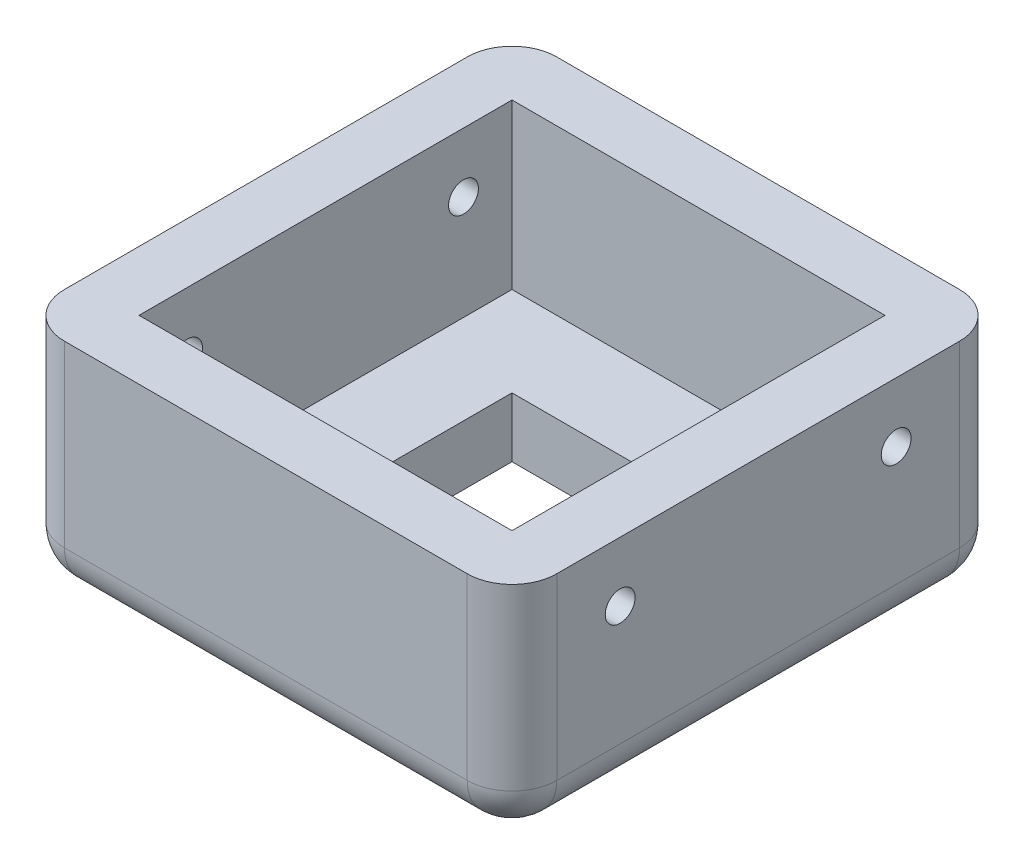
from build123d import *

# Parameters (mm, degrees)
SKETCH_1_W          = 33
SKETCH_1_H          = 33
SKETCH_1_W_2        = 13
SKETCH_1_H_2        = 13
EXTRUDE_1_DEPTH     = 15
SKETCH_2_W          = 25
SKETCH_2_H          = 25
CUT_EXTRUDE_1_DEPTH = 11
FILLET_3_R          = 3
SKETCH_4_R          = 1
CUT_EXTRUDE_2_DEPTH = 43.930175867


with BuildPart() as part:
    # Эскиз1 → Бобышка-Вытянуть1 (new body)
    with BuildSketch(Plane(origin=(0, 0, 0), x_dir=(1, 0, 0), z_dir=(0, 1, 0))):
        with Locations((6.5, 6.5)):
            Rectangle(SKETCH_1_W, SKETCH_1_H)
        with Locations((6.5, 6.5)):
            Rectangle(SKETCH_1_W_2, SKETCH_1_H_2, mode=Mode.SUBTRACT)
    extrude(amount=EXTRUDE_1_DEPTH)

    # Эскиз2 → Вырез-Вытянуть1 (cut)
    with BuildSketch(Plane(origin=(0, 15, 0), x_dir=(1, 0, 0), z_dir=(0, 1, 0))):
        with Locations((6.5, 6.5)):
            Rectangle(SKETCH_2_W, SKETCH_2_H)
    extrude(amount=-CUT_EXTRUDE_1_DEPTH, mode=Mode.SUBTRACT)

    # Скругление3
    fillet_3_edges = [part.edges().sort_by_distance(p)[0] for p in [
        (6.5, 0, -23),
        (23, 0, -6.5),
        (6.5, 0, 10),
        (-10, 0, -6.5),
        (-10, 7.5, -23),
        (23, 7.5, -23),
        (23, 7.5, 10),
        (-10, 7.5, 10),
    ]]
    fillet(fillet_3_edges, radius=FILLET_3_R)

    # Эскиз4 → Вырез-Вытянуть2 (cut, through all)
    with BuildSketch(Plane.ZY.offset(10)):
        with Locations((2.75, 11)):
            Circle(SKETCH_4_R)
        with Locations((-15.75, 11)):
            Circle(SKETCH_4_R)
    extrude(amount=-CUT_EXTRUDE_2_DEPTH, mode=Mode.SUBTRACT)


solid = part.part
